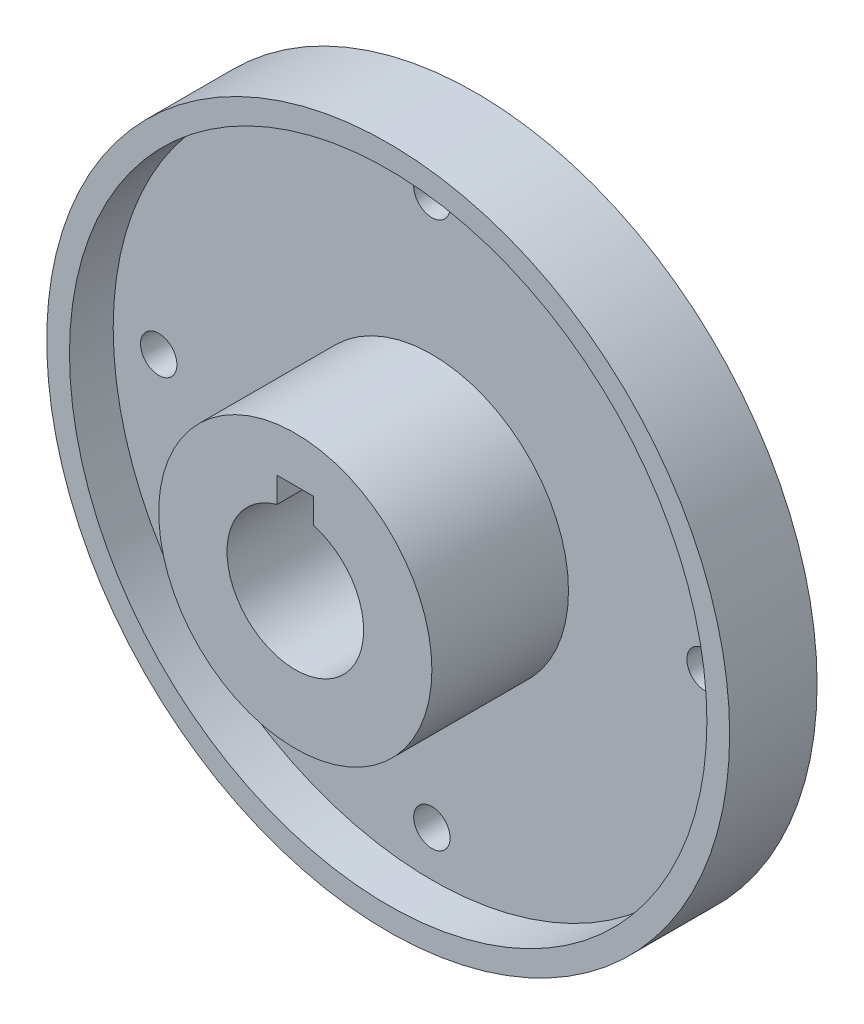
from build123d import *

# Parameters (mm, degrees)
SKETCH1_R           = 75
BOSS_EXTRUDE3_DEPTH = 19.2
SKETCH3_R           = 70
CUT_EXTRUDE1_DEPTH  = 9.6
SKETCH4_R           = 30
BOSS_EXTRUDE4_DEPTH = 30
SKETCH5_R           = 15
CUT_EXTRUDE2_DEPTH  = 57
SKETCH6_R           = 4
CUT_EXTRUDE3_DEPTH  = 57
SKETCH7_W           = 8
SKETCH7_H           = 10
CUT_EXTRUDE4_DEPTH  = 30


with BuildPart() as part:
    # Sketch1 → Boss-Extrude3 (new body)
    with BuildSketch(Plane.XY):
        Circle(SKETCH1_R)
    extrude(amount=BOSS_EXTRUDE3_DEPTH)

    # Sketch3 → Cut-Extrude1 (cut)
    with BuildSketch(Plane.XY.offset(19.2)):
        Circle(SKETCH3_R)
    extrude(amount=-CUT_EXTRUDE1_DEPTH, mode=Mode.SUBTRACT)

    # Sketch4 → Boss-Extrude4 (add)
    with BuildSketch(Plane.XY.offset(9.6)):
        Circle(SKETCH4_R)
    extrude(amount=BOSS_EXTRUDE4_DEPTH)

    # Sketch5 → Cut-Extrude2 (cut)
    with BuildSketch(Plane.XY.offset(39.6)):
        Circle(SKETCH5_R)
    extrude(amount=-CUT_EXTRUDE2_DEPTH, mode=Mode.SUBTRACT)

    # Sketch6 → Cut-Extrude3 (cut)
    with BuildSketch(Plane.XY.offset(9.6)):
        with Locations((0, 60)):
            Circle(SKETCH6_R)
        with Locations((60, 0)):
            Circle(SKETCH6_R)
        with Locations((0, -60)):
            Circle(SKETCH6_R)
        with Locations((-60, 0)):
            Circle(SKETCH6_R)
    extrude(amount=-CUT_EXTRUDE3_DEPTH, mode=Mode.SUBTRACT)

    # Sketch7 → Cut-Extrude4 (cut)
    with BuildSketch(Plane.XY.offset(39.6)):
        with Locations((0, 15)):
            Rectangle(SKETCH7_W, SKETCH7_H)
    extrude(amount=-CUT_EXTRUDE4_DEPTH, mode=Mode.SUBTRACT)


solid = part.part
